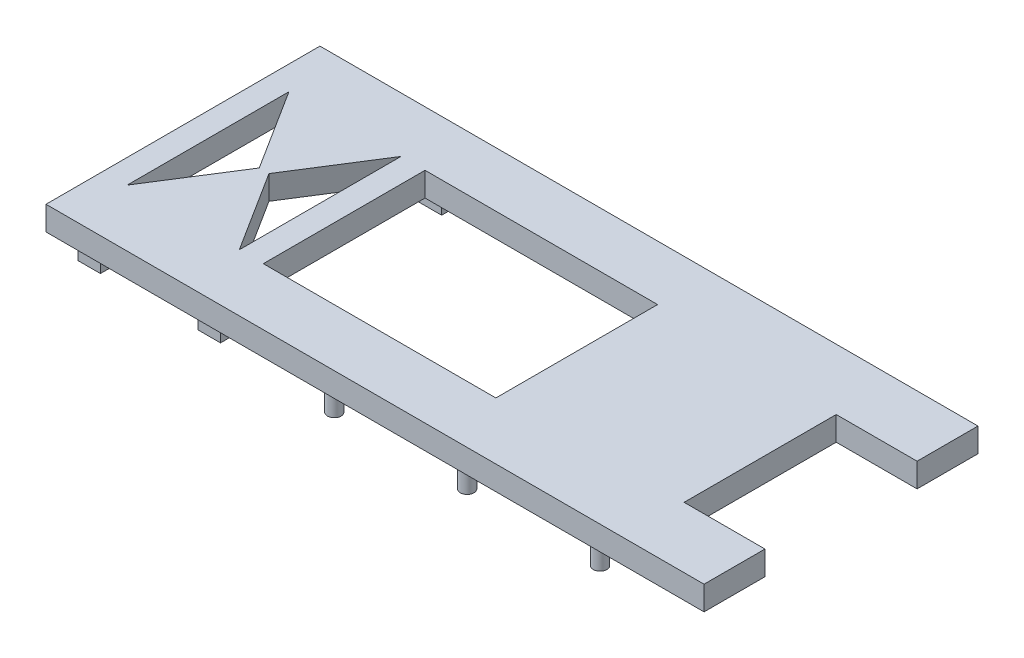
from build123d import *

# Parameters (mm, degrees)
SKETCH1_W           = 55.1
SKETCH1_H           = 27.8
BOSS_EXTRUDE1_DEPTH = 3
SKETCH3_W           = 21.65
SKETCH3_H           = 20.203759547
SKETCH3_W_2         = 17.65
SKETCH3_H_2         = 15.75
CUT_EXTRUDE1_DEPTH  = 32.00342723
SKETCH4_W           = 19.154601746
SKETCH4_H           = 20.203759547
CUT_EXTRUDE2_DEPTH  = 32.00342723
CUT_EXTRUDE3_DEPTH  = 10
SKETCH7_W           = 4.4
SKETCH7_H           = 3
BOSS_EXTRUDE2_DEPTH = 4.1
SKETCH8_W           = 3.662724417
SKETCH8_H           = 3
SKETCH8_W_2         = 3.933516036
BOSS_EXTRUDE3_DEPTH = 3
SKETCH9_W           = 62.2
SKETCH9_H           = 3
BOSS_EXTRUDE4_DEPTH = 3.21
SKETCH10_W          = 62.2
SKETCH10_H          = 3
BOSS_EXTRUDE5_DEPTH = 3.21
SKETCH12_W          = 34.22
SKETCH12_H          = 3
BOSS_EXTRUDE7_DEPTH = 20
CUT_EXTRUDE4_DEPTH  = 54.451422806
SKETCH14_W          = 2.8
SKETCH14_H          = 2.8
BOSS_EXTRUDE8_DEPTH = 3
SKETCH11_R          = 0.85
BOSS_EXTRUDE9_DEPTH = 3


with BuildPart() as part:
    # Sketch1 → Boss-Extrude1 (new body)
    with BuildSketch(Plane(origin=(0, 0, 0), x_dir=(1, 0, 0), z_dir=(0, 1, 0))):
        Rectangle(SKETCH1_W, SKETCH1_H)
    extrude(amount=BOSS_EXTRUDE1_DEPTH)

    # Sketch3 → Cut-Extrude1 (cut, through all)
    # profile 1 of 2: a face of its own
    with BuildSketch(Plane.XZ):
        with Locations((-12.325, -0.13539581)):
            Rectangle(SKETCH3_W, SKETCH3_H)
        with Locations((-12.325, -0.375)):
            Rectangle(SKETCH3_W_2, SKETCH3_H_2, mode=Mode.SUBTRACT)
    # profile 2 of 2: a face of its own
    with BuildSketch(Plane.XZ):
        with Locations((-12.325, -0.375)):
            Rectangle(SKETCH3_W_2, SKETCH3_H_2)
    extrude(amount=-CUT_EXTRUDE1_DEPTH, mode=Mode.SUBTRACT)

    # Sketch4 → Cut-Extrude2 (cut, through all)
    with BuildSketch(Plane(origin=(0, 3, 0), x_dir=(1, 0, 0), z_dir=(0, 1, 0))):
        with Locations((-32.727300873, 0.13539581)):
            Rectangle(SKETCH4_W, SKETCH4_H)
    extrude(amount=-CUT_EXTRUDE2_DEPTH, mode=Mode.SUBTRACT)

    # Sketch5 → Cut-Extrude3 (cut)
    with BuildSketch(Plane(origin=(0, 3, 0), x_dir=(1, 0, 0), z_dir=(0, 1, 0))):
        Polygon((27.55, -9.5), (27.55, 0), (27.55, 9.5), (21.55, 9.5), (21.55, -9.5), align=None)
    extrude(amount=-CUT_EXTRUDE3_DEPTH, mode=Mode.SUBTRACT)

    # Sketch7 → Boss-Extrude2 (add)
    with BuildSketch(Plane(origin=(27.55, 0, 0), x_dir=(0, 0, -1), z_dir=(1, 0, 0))):
        with Locations((11.7, 1.5)):
            Rectangle(SKETCH7_W, SKETCH7_H)
        with Locations((-11.7, 1.5)):
            Rectangle(SKETCH7_W, SKETCH7_H)
    extrude(amount=BOSS_EXTRUDE2_DEPTH)

    # Sketch8 → Boss-Extrude3 (add)
    with BuildSketch(Plane.ZY.offset(27.55)):
        with Locations((-12.068637792, 1.5)):
            Rectangle(SKETCH8_W, SKETCH8_H)
        with Locations((11.933241982, 1.5)):
            Rectangle(SKETCH8_W_2, SKETCH8_H)
    extrude(amount=BOSS_EXTRUDE3_DEPTH)

    # Sketch9 → Boss-Extrude4 (add)
    with BuildSketch(Plane(origin=(0, 0, -13.9), x_dir=(-1, 0, 0), z_dir=(0, 0, -1))):
        with Locations((-0.55, 1.5)):
            Rectangle(SKETCH9_W, SKETCH9_H)
    extrude(amount=BOSS_EXTRUDE4_DEPTH)

    # Sketch10 → Boss-Extrude5 (add)
    with BuildSketch(Plane.XY.offset(13.9)):
        with Locations((0.55, 1.5)):
            Rectangle(SKETCH10_W, SKETCH10_H)
    extrude(amount=BOSS_EXTRUDE5_DEPTH)

    # Sketch12 → Boss-Extrude7 (add)
    with BuildSketch(Plane.ZY.offset(30.55)):
        with Locations((0, 1.5)):
            Rectangle(SKETCH12_W, SKETCH12_H)
    extrude(amount=BOSS_EXTRUDE7_DEPTH)

    # Sketch13 → Cut-Extrude4 (cut, through all)
    with BuildSketch(Plane(origin=(0, 3, 0), x_dir=(1, 0, 0), z_dir=(0, 1, 0))):
        Polygon((-33.55, 10.237275583), (-33.55, -9.966483964), (-39.942079041, 0.13539581), align=None)
        Polygon((-47.55, 10.237275583), (-47.55, -9.966483964), (-41.157920959, 0.13539581), align=None)
    extrude(amount=-CUT_EXTRUDE4_DEPTH, mode=Mode.SUBTRACT)

    # Sketch14 → Boss-Extrude8 (add)
    with BuildSketch(Plane.XZ):
        with Locations((-47.05, 13.81)):
            Rectangle(SKETCH14_W, SKETCH14_H)
        with Locations((-47.05, -13.81)):
            Rectangle(SKETCH14_W, SKETCH14_H)
        with Locations((-32.05, 13.81)):
            Rectangle(SKETCH14_W, SKETCH14_H)
        with Locations((-32.05, -13.81)):
            Rectangle(SKETCH14_W, SKETCH14_H)
    extrude(amount=BOSS_EXTRUDE8_DEPTH)

    # Sketch11 → Boss-Extrude9 (add)
    with BuildSketch(Plane.XZ):
        with Locations(Location((-16.05, 15.6, 0), (0, 0, 90))):
            Circle(SKETCH11_R)
        with Locations(Location((-16.05, -15.6, 0), (0, 0, 90))):
            Circle(SKETCH11_R)
        with Locations(Location((0.55, -15.6, 0), (0, 0, 90))):
            Circle(SKETCH11_R)
        with Locations(Location((0.55, 15.6, 0), (0, 0, 90))):
            Circle(SKETCH11_R)
        with Locations(Location((17.15, 15.6, 0), (0, 0, 90))):
            Circle(SKETCH11_R)
        with Locations(Location((17.15, -15.6, 0), (0, 0, 90))):
            Circle(SKETCH11_R)
    extrude(amount=BOSS_EXTRUDE9_DEPTH)


solid = part.part
